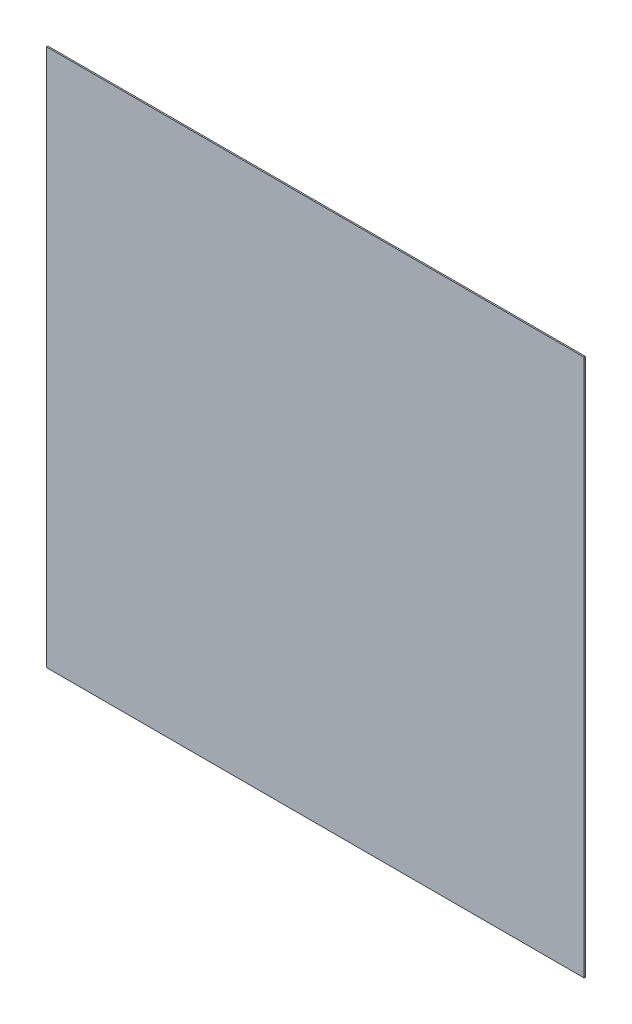
from build123d import *

# Parameters (mm, degrees)
SKETCH1_W           = 50.8
SKETCH1_H           = 50.8
BOSS_EXTRUDE1_DEPTH = 0.127


with BuildPart() as part:
    # Sketch1 → Boss-Extrude1 (new body)
    with BuildSketch(Plane.XY):
        Rectangle(SKETCH1_W, SKETCH1_H)
    extrude(amount=BOSS_EXTRUDE1_DEPTH)


solid = part.part
